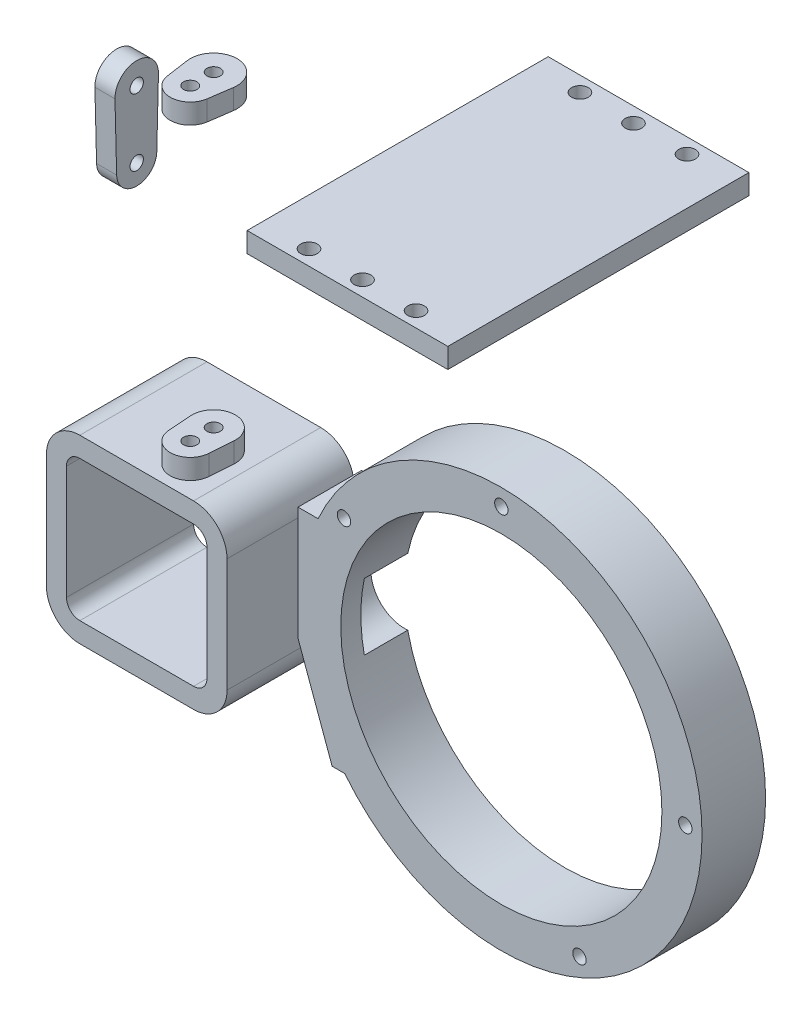
from build123d import *

# Parameters (mm, degrees)
SKETCH1_W           = 30
SKETCH1_H           = 45
SKETCH1_R           = 1.25
LASER_IF_DEPTH      = 3
SKETCH2_R           = 1
FLIR_IF_DEPTH       = 6.5
SKETCH7_R           = 24
SKETCH7_R_2         = 1
FLIR_IF_TOP_DEPTH   = 3
LWIR_IF_DEPTH       = 19
SKETCH4_R           = 1
BOSS_EXTRUDE4_DEPTH = 3
SKETCH5_R           = 1
BOSS_EXTRUDE5_DEPTH = 3
SKETCH6_R           = 1
BOSS_EXTRUDE6_DEPTH = 3


with BuildPart() as part:
    # Sketch1 → LASER IF (new body)
    with BuildSketch(Plane(origin=(0, 22.5, 0), x_dir=(1, 0, 0), z_dir=(0, 1, 0))):
        with Locations((39, 16.5)):
            Rectangle(SKETCH1_W, SKETCH1_H)
        with Locations(Location((47, -3.75, 0), (0, 0, 270))):
            Circle(SKETCH1_R, mode=Mode.SUBTRACT)
        with Locations(Location((39, -3.75, 0), (0, 0, 270))):
            Circle(SKETCH1_R, mode=Mode.SUBTRACT)
        with Locations(Location((31, -3.75, 0), (0, 0, 270))):
            Circle(SKETCH1_R, mode=Mode.SUBTRACT)
        with Locations(Location((47, 36.75, 0), (0, 0, 270))):
            Circle(SKETCH1_R, mode=Mode.SUBTRACT)
        with Locations(Location((39, 36.75, 0), (0, 0, 270))):
            Circle(SKETCH1_R, mode=Mode.SUBTRACT)
        with Locations(Location((31, 36.75, 0), (0, 0, 270))):
            Circle(SKETCH1_R, mode=Mode.SUBTRACT)
    extrude(amount=LASER_IF_DEPTH)


with BuildPart() as body_2:
    # Sketch2 → FLIR IF (new body)
    with BuildSketch(Plane.XY.offset(-24)):
        with BuildLine():
            Line((14.112980393, -27), (11.112980393, -27))
            Line((11.112980393, -27), (11.112980393, -44))
            Line((11.112980393, -44), (16.208563672, -58))
            Line((16.208563672, -58), (18.084897506, -58))
            ThreePointArc((18.084897506, -58), (71.256745496, -35.432831104), (14.112980393, -27))
        make_face()
        with Locations(Location((53.177272727, -64.14307093, 0), (0, 0, 180))):
            Circle(SKETCH2_R, mode=Mode.SUBTRACT)
        with Locations(Location((69, -39.245454545, 0), (0, 0, 180))):
            Circle(SKETCH2_R, mode=Mode.SUBTRACT)
        with Locations(Location((17.9773083, -25, 0), (0, 0, 180))):
            Circle(SKETCH2_R, mode=Mode.SUBTRACT)
        with Locations(Location((41.5, -11.745454545, 0), (0, 0, 180))):
            Circle(SKETCH2_R, mode=Mode.SUBTRACT)
        with BuildLine():
            ThreePointArc((18.020833333, -44.218253821), (65.5, -39.245454545), (18.020833333, -34.27265527))
            ThreePointArc((18.020833333, -34.27265527), (12.5, -39.245454545), (18.020833333, -44.218253821))
        make_face(mode=Mode.SUBTRACT)
    extrude(amount=FLIR_IF_DEPTH)

    # Sketch7 → FLIR IF TOP (add)
    with BuildSketch(Plane.XY.offset(-17.5)):
        with BuildLine():
            Line((14.112980393, -27), (11.112980393, -27))
            Line((11.112980393, -27), (11.112980393, -44))
            Line((11.112980393, -44), (16.208563672, -58))
            Line((16.208563672, -58), (18.084897506, -58))
            ThreePointArc((18.084897506, -58), (71.256745496, -35.432831104), (14.112980393, -27))
        make_face()
        with Locations(Location((41.5, -39.245454545, 0), (0, 0, 191.958313593))):
            Circle(SKETCH7_R, mode=Mode.SUBTRACT)
        with Locations(Location((53.177272727, -64.14307093, 0), (0, 0, 180))):
            Circle(SKETCH7_R_2, mode=Mode.SUBTRACT)
        with Locations(Location((69, -39.245454545, 0), (0, 0, 180))):
            Circle(SKETCH7_R_2, mode=Mode.SUBTRACT)
        with Locations(Location((41.5, -11.745454545, 0), (0, 0, 180))):
            Circle(SKETCH7_R_2, mode=Mode.SUBTRACT)
        with Locations(Location((17.9773083, -25, 0), (0, 0, 180))):
            Circle(SKETCH7_R_2, mode=Mode.SUBTRACT)
    extrude(amount=FLIR_IF_TOP_DEPTH)


with BuildPart() as body_3:
    # Sketch3 → LWIR IF (new body)
    with BuildSketch(Plane.XY.offset(-5)):
        with BuildLine():
            Line((-17, -29.5), (-17, -38))
            Line((-17, -38), (-17, -46.5))
            ThreePointArc((-17, -46.5), (-15.535533906, -50.035533906), (-12, -51.5))
            Line((-12, -51.5), (-3.5, -51.5))
            Line((-3.5, -51.5), (5, -51.5))
            ThreePointArc((5, -51.5), (8.535533906, -50.035533906), (10, -46.5))
            Line((10, -46.5), (10, -38))
            Line((10, -38), (10, -29.5))
            ThreePointArc((10, -29.5), (8.535533906, -25.964466094), (5, -24.5))
            Line((5, -24.5), (-3.5, -24.5))
            Line((-3.5, -24.5), (-12, -24.5))
            ThreePointArc((-12, -24.5), (-15.535533906, -25.964466094), (-17, -29.5))
        make_face()
        with BuildLine():
            Line((-14, -29.5), (-14, -38))
            Line((-14, -38), (-14, -46.5))
            ThreePointArc((-14, -46.5), (-13.414213562, -47.914213562), (-12, -48.5))
            Line((-12, -48.5), (-3.5, -48.5))
            Line((-3.5, -48.5), (5, -48.5))
            ThreePointArc((5, -48.5), (6.414213562, -47.914213562), (7, -46.5))
            Line((7, -46.5), (7, -38))
            Line((7, -38), (7, -29.5))
            ThreePointArc((7, -29.5), (6.414213562, -28.085786438), (5, -27.5))
            Line((5, -27.5), (-3.5, -27.5))
            Line((-3.5, -27.5), (-12, -27.5))
            ThreePointArc((-12, -27.5), (-13.414213562, -28.085786438), (-14, -29.5))
        make_face(mode=Mode.SUBTRACT)
    extrude(amount=-LWIR_IF_DEPTH)

    # Sketch6 → Boss-Extrude6 (add)
    # profile 1 of 2: a face of its own
    with BuildSketch(Plane.XZ.offset(21.5)):
        with BuildLine():
            Line((-2.124689036, -53.047069353), (0.156586878, -48.925991799))
            ThreePointArc((0.156586878, -48.925991799), (4.722496555, -47.744005512), (5.660828852, -52.366143033))
            Line((5.660828852, -52.366143033), (2.95614971, -56.222593569))
            ThreePointArc((2.95614971, -56.222593569), (-1.08999682, -57.043994912), (-2.124689036, -53.047069353))
        make_face()
        with Locations(Location((3, -50.5, 0), (0, 0, 270))):
            Circle(SKETCH6_R, mode=Mode.SUBTRACT)
        with Locations(Location((0.5, -54.5, 0), (0, 0, 270))):
            Circle(SKETCH6_R, mode=Mode.SUBTRACT)
    # profile 2 of 2: a face of its own
    with BuildSketch(Plane.XZ.offset(21.5)):
        with BuildLine():
            Line((-3.241698582, -12.767857143), (-2.992337152, -9.285714286))
            ThreePointArc((-2.992337152, -9.285714286), (0, -6.5), (2.992337152, -9.285714286))
            Line((2.992337152, -9.285714286), (3.241698582, -12.767857143))
            ThreePointArc((3.241698582, -12.767857143), (0, -16.25), (-3.241698582, -12.767857143))
        make_face()
        with Locations(Location((0, -9.5, 0), (0, 0, 90))):
            Circle(SKETCH6_R, mode=Mode.SUBTRACT)
        with Locations(Location((0, -13, 0), (0, 0, 90))):
            Circle(SKETCH6_R, mode=Mode.SUBTRACT)
    extrude(amount=BOSS_EXTRUDE6_DEPTH)


with BuildPart() as body_4:
    # Sketch4 → Boss-Extrude4 (new body)
    with BuildSketch(Plane(origin=(0, 21.5, 0), x_dir=(1, 0, 0), z_dir=(0, 1, 0))):
        with BuildLine():
            Line((3.464101615, 12.5), (2.969229956, 9.071428571))
            ThreePointArc((2.969229956, 9.071428571), (0, 6.5), (-2.969229956, 9.071428571))
            Line((-2.969229956, 9.071428571), (-3.464101615, 12.5))
            ThreePointArc((-3.464101615, 12.5), (0, 16.5), (3.464101615, 12.5))
        make_face()
        with Locations(Location((0, 13, 0), (0, 0, 270))):
            Circle(SKETCH4_R, mode=Mode.SUBTRACT)
        with Locations(Location((0, 9.5, 0), (0, 0, 270))):
            Circle(SKETCH4_R, mode=Mode.SUBTRACT)
    extrude(amount=BOSS_EXTRUDE4_DEPTH)


with BuildPart() as body_5:
    # Sketch5 → Boss-Extrude5 (new body)
    with BuildSketch(Plane.ZY.offset(18.5)):
        with BuildLine():
            Line((-22.999062353, -0.075), (-23.248984216, 9.91875))
            ThreePointArc((-23.248984216, 9.91875), (-20, 13.25), (-16.751015784, 9.91875))
            Line((-16.751015784, 9.91875), (-17.000937647, -0.075))
            ThreePointArc((-17.000937647, -0.075), (-20, -3), (-22.999062353, -0.075))
        make_face()
        with Locations((-20, 0)):
            Circle(SKETCH5_R, mode=Mode.SUBTRACT)
        with Locations((-20, 10)):
            Circle(SKETCH5_R, mode=Mode.SUBTRACT)
    extrude(amount=BOSS_EXTRUDE5_DEPTH)


with BuildPart() as boss_extrude6_piece_1:
    # of the separate pieces the step leaves, piece 1, a body of its own (boss_extrude6_pieces)
    add(body_3.part.solids().sort_by_distance((10, -29.5, -5))[0])


with BuildPart() as boss_extrude6_piece_2:
    # of the separate pieces the step leaves, piece 2, a body of its own (boss_extrude6_pieces)
    add(body_3.part.solids().sort_by_distance((-2.124689036, -21.5, -53.047069353))[0])


solid = Compound([part.part, body_2.part, body_4.part, body_5.part, boss_extrude6_piece_1.part, boss_extrude6_piece_2.part])
